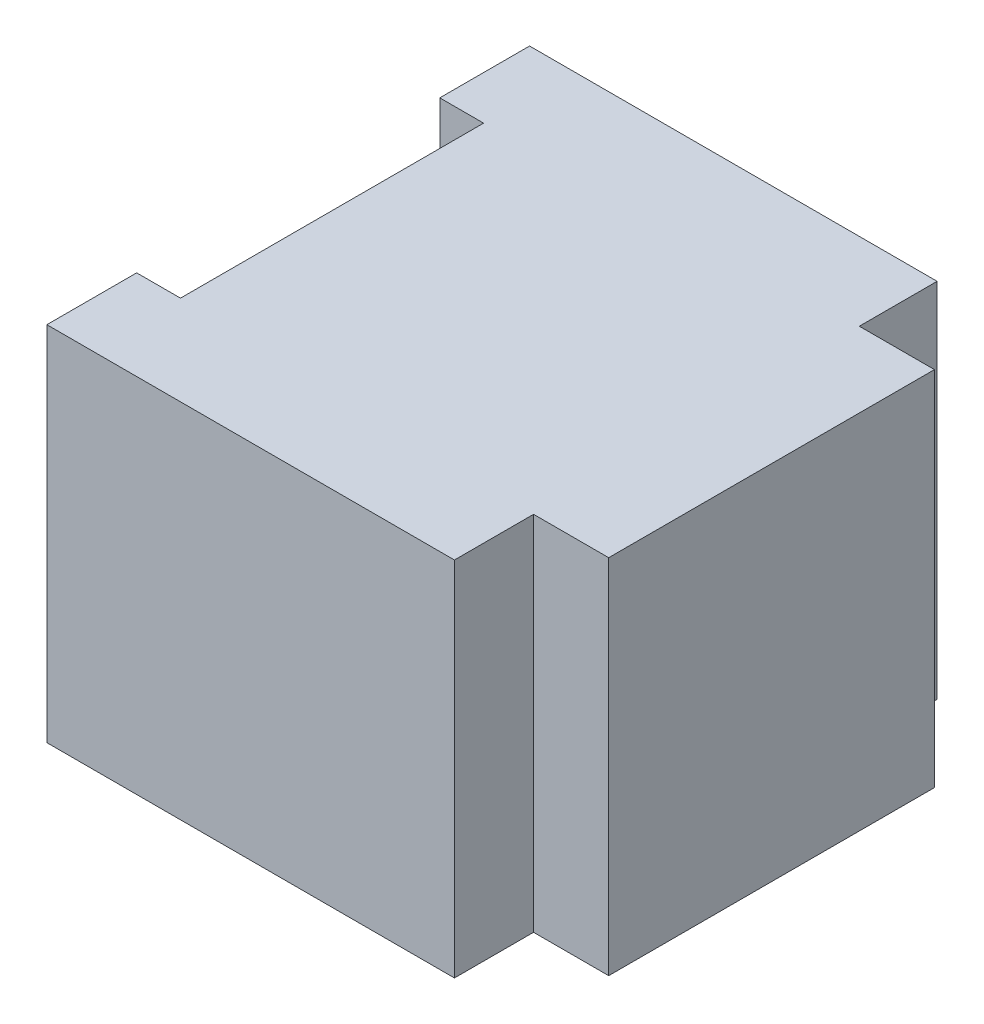
from build123d import *

# Parameters (mm, degrees)
SKETCH1_W           = 80
SKETCH1_H           = 80
BOSS_EXTRUDE1_DEPTH = 60
SKETCH2_W           = 7.262949675
SKETCH2_H           = 50.237294764
CUT_EXTRUDE1_DEPTH  = 83.462112512
SKETCH3_W           = 12.452296607
SKETCH3_H           = 12.893943155
SKETCH3_H_2         = 13.114766428
CUT_EXTRUDE2_DEPTH  = 83.462112512


with BuildPart() as part:
    # Sketch1 → Boss-Extrude1 (new body)
    with BuildSketch(Plane(origin=(0, 0, 0), x_dir=(1, 0, 0), z_dir=(0, 1, 0))):
        Rectangle(SKETCH1_W, SKETCH1_H)
    extrude(amount=BOSS_EXTRUDE1_DEPTH)

    # Sketch2 → Cut-Extrude1 (cut, through all)
    with BuildSketch(Plane(origin=(0, 60, 0), x_dir=(1, 0, 0), z_dir=(0, 1, 0))):
        with Locations((-36.368525163, 0)):
            Rectangle(SKETCH2_W, SKETCH2_H)
    extrude(amount=-CUT_EXTRUDE1_DEPTH, mode=Mode.SUBTRACT)

    # Sketch3 → Cut-Extrude2 (cut, through all)
    with BuildSketch(Plane(origin=(0, 60, 0), x_dir=(1, 0, 0), z_dir=(0, 1, 0))):
        with Locations((33.773851697, 33.553028422)):
            Rectangle(SKETCH3_W, SKETCH3_H)
        with Locations((33.773851697, -33.442616786)):
            Rectangle(SKETCH3_W, SKETCH3_H_2)
    extrude(amount=-CUT_EXTRUDE2_DEPTH, mode=Mode.SUBTRACT)


solid = part.part
